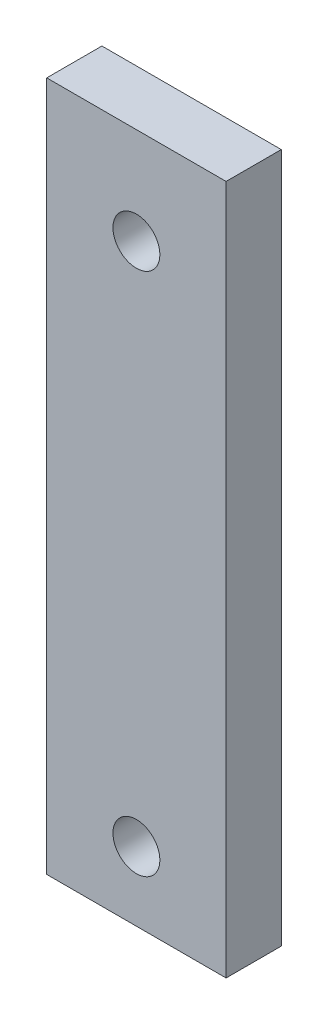
from build123d import *

# Parameters (mm, degrees)
SKETCH1_W           = 65
SKETCH1_H           = 250
BOSS_EXTRUDE1_DEPTH = 20
SKETCH3_R           = 8.5
CUT_EXTRUDE2_DEPTH  = 28


with BuildPart() as part:
    # Sketch1 → Boss-Extrude1 (new body)
    with BuildSketch(Plane.XY):
        Rectangle(SKETCH1_W, SKETCH1_H)
    extrude(amount=BOSS_EXTRUDE1_DEPTH)

    # Sketch3 → Cut-Extrude2 (cut)
    with BuildSketch(Plane.XY):
        with Locations((0, -100)):
            Circle(SKETCH3_R)
        with Locations((0, 90)):
            Circle(SKETCH3_R)
    extrude(amount=CUT_EXTRUDE2_DEPTH, mode=Mode.SUBTRACT)


solid = part.part
